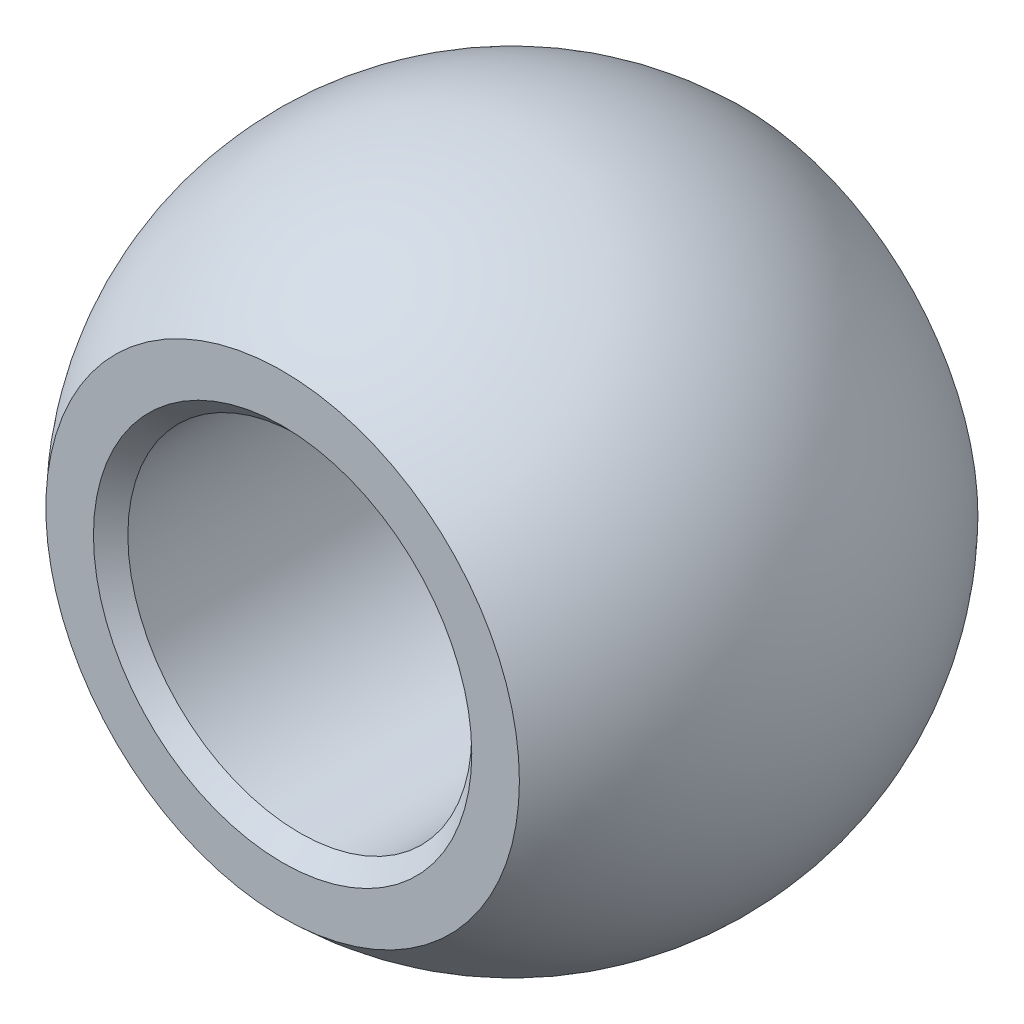
from build123d import *

# Parameters (mm, degrees)
CUT_EXTRUDE4_DEPTH      = 30.558529563
CUT_EXTRUDE4_DEPTH_BACK = 30.558529563
SKETCH10_R              = 4.7625
CUT_EXTRUDE7_START      = -6.35
SKETCH22_W              = 25.4
SKETCH22_H              = 30.1625
CUT_EXTRUDE7_DEPTH      = 24.208529563
CUT_EXTRUDE8_START      = 6.35
SKETCH23_W              = 25.4
SKETCH23_H              = 30.1625
CUT_EXTRUDE8_DEPTH      = 24.208529563
CHAMFER2_SIZE           = 0.47625


with BuildPart() as part:
    # Sketch7 → Revolve3 (revolve)
    with BuildSketch(Plane.XY):
        with BuildLine():
            Line((0, 26.590625), (0, 8.334375))
            ThreePointArc((0, 8.334375), (9.128125, 17.4625), (0, 26.590625))
        make_face()
    revolve(axis=Axis((0, 0, 0), (0, 1, 0)))

    # Sketch10 → Cut-Extrude4 (cut, two sides: drawn at the far end of the back side and taken through both)
    with BuildSketch(Plane.XY.offset(-CUT_EXTRUDE4_DEPTH_BACK)):
        with Locations(Location((0, 17.4625, 0), (0, 0, 180))):
            Circle(SKETCH10_R)
    extrude(amount=CUT_EXTRUDE4_DEPTH + CUT_EXTRUDE4_DEPTH_BACK, mode=Mode.SUBTRACT)

    # Sketch22 → Cut-Extrude7 (cut, through all)
    with BuildSketch(Plane.XY.offset(CUT_EXTRUDE7_START)):
        with Locations((0, 15.08125)):
            Rectangle(SKETCH22_W, SKETCH22_H)
    extrude(amount=-CUT_EXTRUDE7_DEPTH, mode=Mode.SUBTRACT)

    # Sketch23 → Cut-Extrude8 (cut, through all)
    with BuildSketch(Plane.XY.offset(CUT_EXTRUDE8_START)):
        with Locations((0, 15.08125)):
            Rectangle(SKETCH23_W, SKETCH23_H)
    extrude(amount=CUT_EXTRUDE8_DEPTH, mode=Mode.SUBTRACT)

    # Chamfer2
    chamfer2_edges = [part.edges().sort_by_distance(p)[0] for p in [
        (4.7625, 17.4625, -6.35),
        (4.7625, 17.4625, 6.35),
    ]]
    chamfer(chamfer2_edges, length=CHAMFER2_SIZE)


solid = part.part
